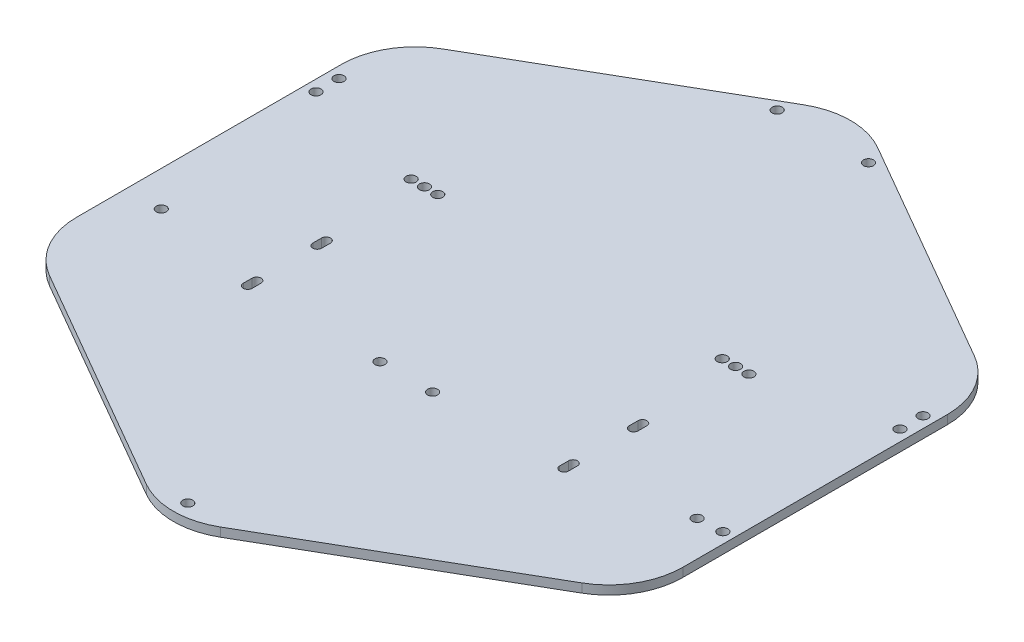
from build123d import *

# Parameters (mm, degrees)
BOSS_EXTRU_1_DEPTH      = 3
CONG_8_R                = 25
D_GAGEMENT_M31_D        = 3.4
ENL_V_MAT_EXTRU_1_DEPTH = 154.69791124
D_GAGEMENT_M35_D        = 3.4
D_GAGEMENT_M35_DEPTH    = 7
D_GAGEMENT_M35_TIP      = 1.021463052


with BuildPart() as part:
    # Esquisse1 → Boss.-Extru.1 (new body)
    with BuildSketch(Plane(origin=(0, 0, 0), x_dir=(1, 0, 0), z_dir=(0, 1, 0))):
        Polygon((-102.5, 59.178402592), (-102.5, -59.178402592), (0, -118.356805184), (102.5, -59.178402592), (102.5, 59.178402592), (0, 118.356805184), align=None)
    extrude(amount=BOSS_EXTRU_1_DEPTH)

    # Congé8
    cong_8_edges = [part.edges().sort_by_distance(p)[0] for p in [
        (0, 1.5, -118.356805184),
        (102.5, 1.5, -59.178402592),
        (102.5, 1.5, 59.178402592),
        (0, 1.5, 118.356805184),
        (-102.5, 1.5, 59.178402592),
        (-102.5, 1.5, -59.178402592),
    ]]
    fillet(cong_8_edges, radius=CONG_8_R)

    # Dégagement M31 (through all)
    with Locations(Plane(origin=(0, 3, 0), x_dir=(1, 0, 0), z_dir=(0, 1, 0))):
        with Locations((57.1, 22.9999993), (48.1, 22.9999993), (52.6, 22.9999993), (-52.6, 22.9999993), (-48.1, 22.9999993), (-57.1, 22.9999993), (-127.319090426, 28.910605245)):
            Hole(D_GAGEMENT_M31_D / 2)

    # Esquisse4 → Enlèv. mat.-Extru.1 (cut, through all)
    with BuildSketch(Plane(origin=(0, 3, 0), x_dir=(1, 0, 0), z_dir=(0, 1, 0))):
        with BuildLine():
            Line((-55, -9.372115214), (-55, -12.372115214))
            ThreePointArc((-55, -12.372115214), (-53.5, -13.872115214), (-52, -12.372115214))
            Line((-52, -12.372115214), (-52, -9.372115214))
            ThreePointArc((-52, -9.372115214), (-53.5, -7.872115214), (-55, -9.372115214))
        make_face()
        with BuildLine():
            Line((-55, -32.872115214), (-55, -35.872115214))
            ThreePointArc((-55, -35.872115214), (-53.5, -37.372115214), (-52, -35.872115214))
            Line((-52, -35.872115214), (-52, -32.872115214))
            ThreePointArc((-52, -32.872115214), (-53.5, -31.372115214), (-55, -32.872115214))
        make_face()
        with BuildLine():
            Line((55, -9.372115214), (55, -12.372115214))
            ThreePointArc((55, -12.372115214), (53.5, -13.872115214), (52, -12.372115214))
            Line((52, -12.372115214), (52, -9.372115214))
            ThreePointArc((52, -9.372115214), (53.5, -7.872115214), (55, -9.372115214))
        make_face()
        with BuildLine():
            Line((55, -32.872115214), (55, -35.872115214))
            ThreePointArc((55, -35.872115214), (53.5, -37.372115214), (52, -35.872115214))
            Line((52, -35.872115214), (52, -32.872115214))
            ThreePointArc((52, -32.872115214), (53.5, -31.372115214), (55, -32.872115214))
        make_face()
    extrude(amount=-ENL_V_MAT_EXTRU_1_DEPTH, mode=Mode.SUBTRACT)

    # Dégagement M35
    with Locations(Plane(origin=(0, 3, 0), x_dir=(1, 0, 0), z_dir=(0, 1, 0))):
        with Locations((-90.594469683, -27.994469683), (-8.9, -35.75), (8.9, -35.75), (0, -109.639291724), (90.594469683, -27.994469683), (98.85, -27.55), (98.75, 32.45), (98.75, 40.25), (15.43813191, 105.113468551), (-15.43813191, 105.113468551), (-98.75, 32.45), (-98.75, 40.25)):
            Hole(D_GAGEMENT_M35_D / 2, depth=D_GAGEMENT_M35_DEPTH)
            with Locations((0, 0, -(D_GAGEMENT_M35_DEPTH + D_GAGEMENT_M35_TIP / 2))):  # 118° drill point
                Cone(0, D_GAGEMENT_M35_D / 2, D_GAGEMENT_M35_TIP, mode=Mode.SUBTRACT)


solid = part.part
